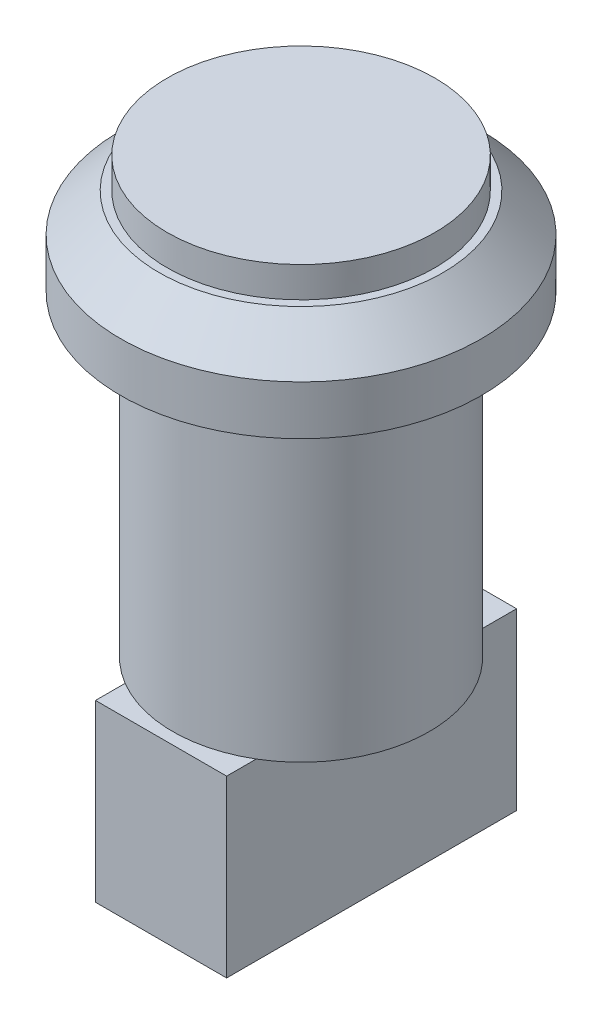
from build123d import *

# Parameters (mm, degrees)
SKETCH1_R           = 12.25
BOSS_EXTRUDE1_DEPTH = 2.8
SKETCH2_R           = 16.5
BOSS_EXTRUDE2_DEPTH = 8
CHAMFER1_SIZE       = 3.5
SKETCH3_R           = 11.75
BOSS_EXTRUDE3_DEPTH = 29
SKETCH4_W           = 12
SKETCH4_H           = 26.533921206
BOSS_EXTRUDE4_DEPTH = 16


with BuildPart() as part:
    # Sketch1 → Boss-Extrude1 (new body)
    with BuildSketch(Plane(origin=(0, 0, 0), x_dir=(1, 0, 0), z_dir=(0, 1, 0))):
        with Locations(Location((0, 0, 0), (0, 0, 270))):
            Circle(SKETCH1_R)
    extrude(amount=BOSS_EXTRUDE1_DEPTH)

    # Sketch2 → Boss-Extrude2 (add)
    with BuildSketch(Plane.XZ):
        with Locations(Location((0, 0, 0), (0, 0, 270))):
            Circle(SKETCH2_R)
    extrude(amount=BOSS_EXTRUDE2_DEPTH)

    # Chamfer1
    chamfer1_edges = [part.edges().sort_by_distance(p)[0] for p in [
        (0, 0, 16.5),
    ]]
    chamfer(chamfer1_edges, length=CHAMFER1_SIZE)

    # Sketch3 → Boss-Extrude3 (add)
    with BuildSketch(Plane.XZ.offset(8)):
        with Locations(Location((0, 0, 0), (0, 0, 90))):
            Circle(SKETCH3_R)
    extrude(amount=BOSS_EXTRUDE3_DEPTH)

    # Sketch4 → Boss-Extrude4 (add)
    with BuildSketch(Plane.XZ.offset(37)):
        with Locations((0, -0.455127293)):
            Rectangle(SKETCH4_W, SKETCH4_H)
    extrude(amount=BOSS_EXTRUDE4_DEPTH)


solid = part.part
